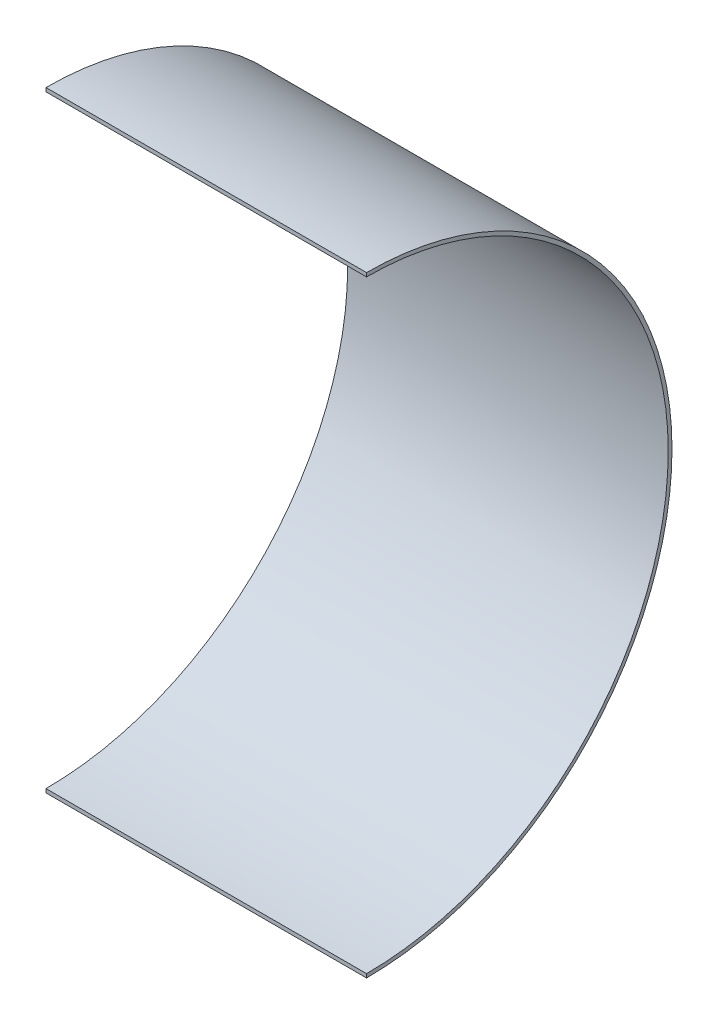
from build123d import *

# Parameters (mm, degrees)
EXTRUDE_THIN1_DEPTH = 215.9


with BuildPart() as part:
    # Sketch1 → Extrude-Thin1 (new body)
    with BuildSketch(Plane(origin=(0, 0, 0), x_dir=(0, 0, -1), z_dir=(1, 0, 0))):
        with BuildLine():
            ThreePointArc((0, -203.2), (203.2, 0), (0, 203.2))
            Line((0, 203.2), (0, 205.74))
            ThreePointArc((0, 205.74), (205.74, 0), (0, -205.74))
            Line((0, -205.74), (0, -203.2))
        make_face()
    extrude(amount=EXTRUDE_THIN1_DEPTH)


solid = part.part
